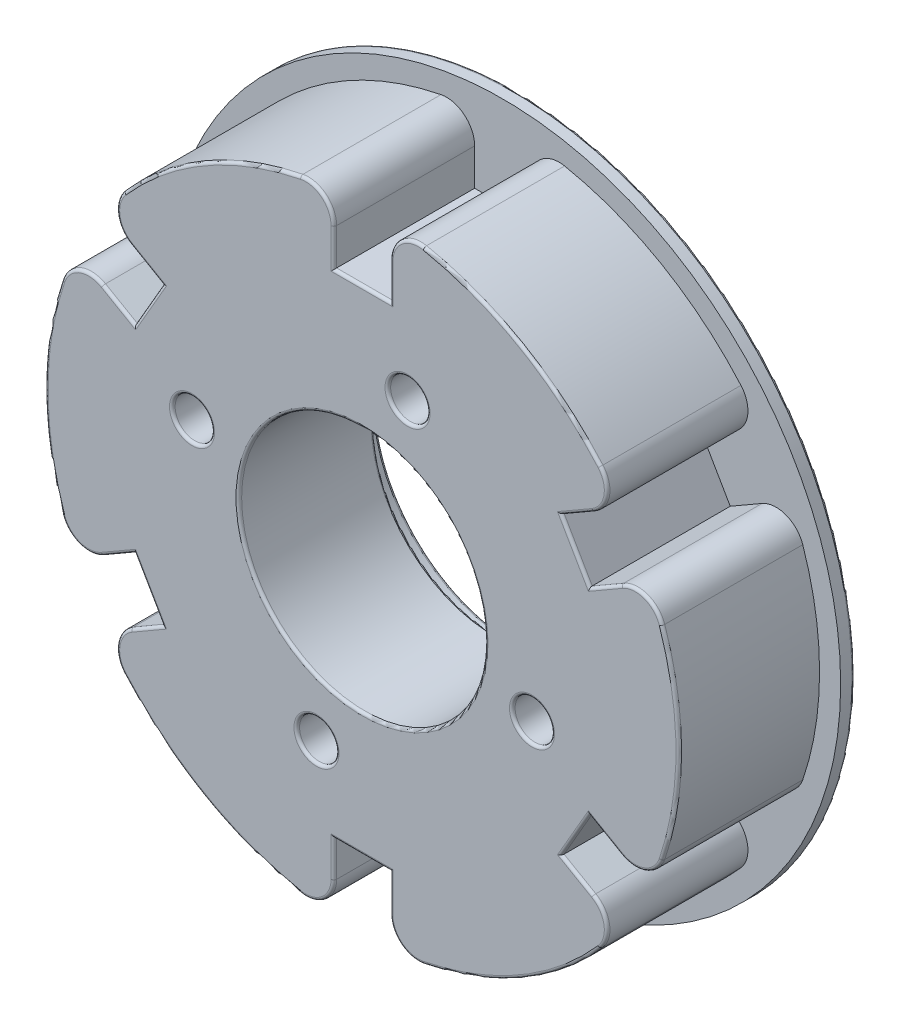
from build123d import *

# Parameters (mm, degrees)
SKETCH1_R                = 28.575
BOSS_EXTRUDE1_DEPTH      = 6.35
SKETCH2_R                = 30.48
BOSS_EXTRUDE2_DEPTH      = 1.27
SKETCH3_W                = 5.08
SKETCH3_H                = 7.62
CUT_EXTRUDE1_DEPTH       = 45.937187273
FILLET1_R                = 2.54
CIRPATTERN1_COUNT        = 6
FILLET1_OF_CIRPATTERN1_R = 2.54
CUT_EXTRUDE4_DEPTH       = 46.312489448
CUT_EXTRUDE4_DEPTH_BACK  = 46.312489448
SKETCH6_R                = 11.1125
CUT_EXTRUDE5_DEPTH       = 46.312489448
CUT_EXTRUDE5_DEPTH_BACK  = 46.312489448
SKETCH7_R                = 1.778
SKETCH9_R                = 12.7
CUT_EXTRUDE6_DEPTH       = 1.778
FILLET2_R                = 0.254


with BuildPart() as part:
    # Sketch1 → Boss-Extrude1 (new, symmetric)
    with BuildSketch(Plane.XY):
        Circle(SKETCH1_R)
    extrude(amount=BOSS_EXTRUDE1_DEPTH, both=True)

    # Sketch2 → Boss-Extrude2 (add)
    with BuildSketch(Plane.XY.offset(-6.35)):
        Circle(SKETCH2_R)
    extrude(amount=-BOSS_EXTRUDE2_DEPTH)

    # Sketch3 → Cut-Extrude1 (cut, through all)
    with BuildSketch(Plane.XY.offset(-6.35)):
        with Locations((0, 26.035)):
            Rectangle(SKETCH3_W, SKETCH3_H)
    cut_extrude1 = extrude(amount=CUT_EXTRUDE1_DEPTH, mode=Mode.SUBTRACT)

    # Fillet1
    fillet1_edges = [part.edges().sort_by_distance(p)[0] for p in [
        (2.54, 28.461887235, 0),
        (-2.54, 28.461887235, 0),
    ]]
    fillet(fillet1_edges, radius=FILLET1_R)

    # CirPattern1: Cut-Extrude1 ×6 about axis
    cirpattern1_axis = Axis((0, 0, 7.0485), (0, 0, -1))
    for i in range(1, CIRPATTERN1_COUNT):
        add(cut_extrude1.rotate(cirpattern1_axis, i * 360 / CIRPATTERN1_COUNT), mode=Mode.SUBTRACT)

    # Fillet1 of CirPattern1
    fillet1_of_cirpattern1_edges = [part.edges().sort_by_distance(p)[0] for p in [
        (25.918717385, 12.031239092, 0),
        (23.378717385, 16.430648143, 0),
        (23.378717385, -16.430648143, 0),
        (25.918717385, -12.031239092, 0),
        (-2.54, -28.461887235, 0),
        (2.54, -28.461887235, 0),
        (-25.918717385, -12.031239092, 0),
        (-23.378717385, -16.430648143, 0),
        (-23.378717385, 16.430648143, 0),
        (-25.918717385, 12.031239092, 0),
    ]]
    fillet(fillet1_of_cirpattern1_edges, radius=FILLET1_OF_CIRPATTERN1_R)

    # Sketch6 → Cut-Extrude4 (cut, two sides: drawn at the far end of the back side and taken through both)
    with BuildSketch(Plane(origin=(0, 0, -7.62), x_dir=(-1, 0, 0), z_dir=(0, 0, -1)).offset(-CUT_EXTRUDE4_DEPTH_BACK)):
        Circle(SKETCH6_R)
    extrude(amount=CUT_EXTRUDE4_DEPTH + CUT_EXTRUDE4_DEPTH_BACK, mode=Mode.SUBTRACT)

    # Sketch7 → Cut-Extrude5 (cut, two sides: drawn at the far end of the back side and taken through both)
    with BuildSketch(Plane(origin=(0, 0, -7.62), x_dir=(-1, 0, 0), z_dir=(0, 0, -1)).offset(-CUT_EXTRUDE5_DEPTH_BACK)):
        with Locations((-15.334072492, -4.108752341)):
            Circle(SKETCH7_R)
        with Locations((-4.108752341, 15.334072492)):
            Circle(SKETCH7_R)
        with Locations((15.334072492, 4.108752341)):
            Circle(SKETCH7_R)
        with Locations((4.108752341, -15.334072492)):
            Circle(SKETCH7_R)
    extrude(amount=CUT_EXTRUDE5_DEPTH + CUT_EXTRUDE5_DEPTH_BACK, mode=Mode.SUBTRACT)

    # Sketch9 → Cut-Extrude6 (cut)
    with BuildSketch(Plane(origin=(0, 0, -7.62), x_dir=(-1, 0, 0), z_dir=(0, 0, -1))):
        Circle(SKETCH9_R)
    extrude(amount=-CUT_EXTRUDE6_DEPTH, mode=Mode.SUBTRACT)

    # Fillet2
    fillet2_edges = [part.edges().sort_by_distance(p)[0] for p in [
        (11.1125, 0, -5.842),
        (-30.48, 0, -7.62),
        (-2.330752341, -15.334072492, -7.62),
        (-13.556072492, 4.108752341, -7.62),
        (5.886752341, 15.334072492, -7.62),
        (17.112072492, -4.108752341, -7.62),
        (12.7, 0, -7.62),
        (-3.468672718, 27.498053497, 6.35),
        (-2.54, 23.879790482, 6.35),
        (0, 22.225, 6.35),
        (2.54, 23.879790482, 6.35),
        (3.468672718, 27.498053497, 6.35),
        (14.2875, 24.746675913, 6.35),
        (22.079676524, 16.75298544, 6.35),
        (19.410505194, 14.139599767, 6.35),
        (19.247414599, 11.1125, 6.35),
        (21.950505194, 9.740190715, 6.35),
        (25.548349242, 10.745068058, 6.35),
        (28.575, 0, 6.35),
        (25.548349242, -10.745068058, 6.35),
        (21.950505194, -9.740190715, 6.35),
        (19.247414599, -11.1125, 6.35),
        (19.410505194, -14.139599767, 6.35),
        (22.079676524, -16.75298544, 6.35),
        (14.2875, -24.746675913, 6.35),
        (3.468672718, -27.498053497, 6.35),
        (2.54, -23.879790482, 6.35),
        (0, -22.225, 6.35),
        (-2.54, -23.879790482, 6.35),
        (-3.468672718, -27.498053497, 6.35),
        (-14.2875, -24.746675913, 6.35),
        (-22.079676524, -16.75298544, 6.35),
        (-19.410505194, -14.139599767, 6.35),
        (-19.247414599, -11.1125, 6.35),
        (-21.950505194, -9.740190715, 6.35),
        (-25.548349242, -10.745068058, 6.35),
        (-28.575, 0, 6.35),
        (-25.548349242, 10.745068058, 6.35),
        (-21.950505194, 9.740190715, 6.35),
        (-19.247414599, 11.1125, 6.35),
        (-19.410505194, 14.139599767, 6.35),
        (-22.079676524, 16.75298544, 6.35),
        (-14.2875, 24.746675913, 6.35),
        (11.1125, 0, 6.35),
        (-2.330752341, -15.334072492, 6.35),
        (-13.556072492, 4.108752341, 6.35),
        (5.886752341, 15.334072492, 6.35),
        (17.112072492, -4.108752341, 6.35),
    ]]
    fillet(fillet2_edges, radius=FILLET2_R)


solid = part.part
